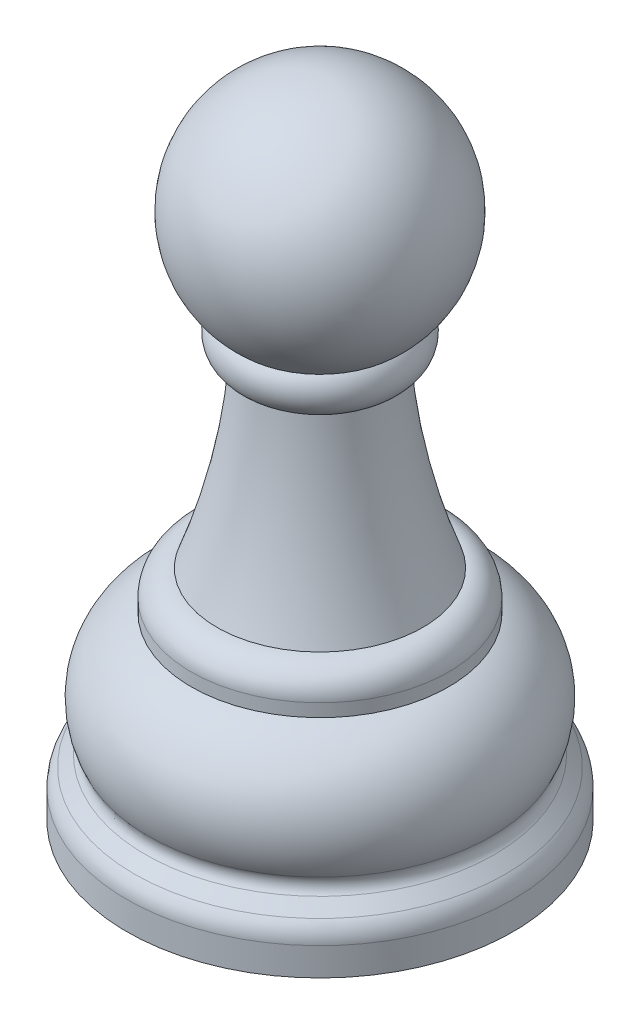
from build123d import *

# Parameters (mm, degrees)
FILLET1_R = 2
FILLET2_R = 1


with BuildPart() as part:
    # Sketch1 → Revolve1 (revolve)
    with BuildSketch(Plane.XY, mode=Mode.PRIVATE) as revolve1_sk:
        with BuildLine():
            Line((0, 0), (0, -50))
            Line((0, -50), (13, -50))
            Line((13, -50), (15, -50))
            Line((15, -50), (15, -47))
            Line((15, -47), (13, -45))
            ThreePointArc((13, -45), (13.689044296, -39.782878162), (10, -36.03))
            Line((10, -36.03), (10, -35.03))
            ThreePointArc((10, -35.03), (9.414213562, -33.615786438), (8, -33.03))
            ThreePointArc((8, -33.03), (5.996281337, -26.137939714), (5, -19.03))
            ThreePointArc((5, -19.03), (6.412519214, -17.679913869), (6, -15.77))
            ThreePointArc((6, -15.77), (8.481867275, -5.799318094), (0, 0))
        make_face()
    revolve(revolve1_sk.sketch.rotate(Axis((0, 0, 0), (0, -1, 0)), 180), axis=Axis((0, 0, 0), (0, -1, 0)))

    # Fillet1
    fillet1_edges = [part.edges().sort_by_distance(p)[0] for p in [
        (15, -47, 0),
    ]]
    fillet(fillet1_edges, radius=FILLET1_R)

    # Fillet2
    fillet2_edges = [part.edges().sort_by_distance(p)[0] for p in [
        (13, -45, 0),
    ]]
    fillet(fillet2_edges, radius=FILLET2_R)


solid = part.part
